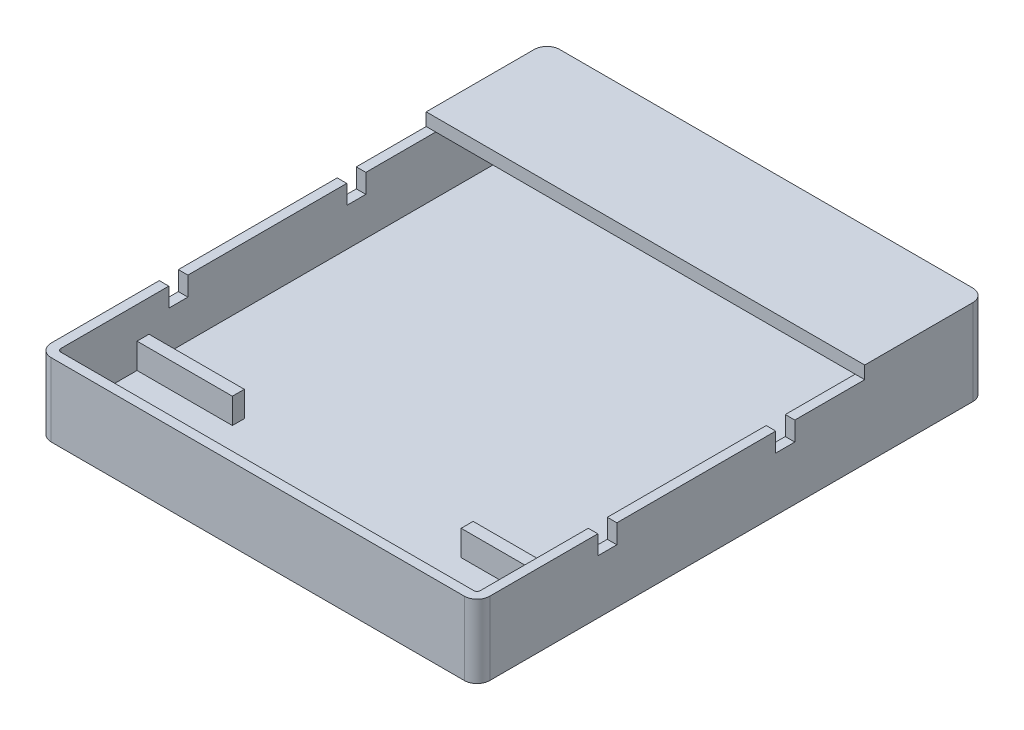
from build123d import *

# Parameters (mm, degrees)
EXTRUDE_1_DEPTH     = 2.5
EXTRUDE_2_DEPTH     = 9
SKETCH_6_W          = 14
SKETCH_6_H          = 8
SKETCH_6_W_2        = 9
SKETCH_6_H_2        = 5
CUT_EXTRUDE_3_DEPTH = 9
SKETCH_7_W          = 10
SKETCH_7_H          = 1.5
EXTRUDE_3_DEPTH     = 1
SKETCH_8_W          = 3
SKETCH_8_H          = 3
CUT_EXTRUDE_4_DEPTH = 5
EXTRUDE_4_DEPTH     = 2
SKETCH_10_W         = 15
SKETCH_10_H         = 1.883979019
EXTRUDE_5_DEPTH     = 4


with BuildPart() as part:
    # 草图1 → 凸台-拉伸1 (new body)
    with BuildSketch(Plane(origin=(0, 0, 0), x_dir=(1, 0, 0), z_dir=(0, 1, 0))):
        with BuildLine():
            Line((-32.5, 40), (32.5, 40))
            ThreePointArc((32.5, 40), (33.914213562, 39.414213562), (34.5, 38))
            Line((34.5, 38), (34.5, -38))
            ThreePointArc((34.5, -38), (33.914213562, -39.414213562), (32.5, -40))
            Line((32.5, -40), (-32.5, -40))
            ThreePointArc((-32.5, -40), (-33.914213562, -39.414213562), (-34.5, -38))
            Line((-34.5, -38), (-34.5, 38))
            ThreePointArc((-34.5, 38), (-33.914213562, 39.414213562), (-32.5, 40))
        make_face()
    extrude(amount=EXTRUDE_1_DEPTH)

    # 草图2 → 凸台-拉伸2 (add)
    with BuildSketch(Plane(origin=(0, 2.5, 0), x_dir=(1, 0, 0), z_dir=(0, 1, 0))):
        with BuildLine():
            Line((-32.5, -40), (32.5, -40))
            ThreePointArc((32.5, -40), (33.914213562, -39.414213562), (34.5, -38))
            Line((34.5, -38), (34.5, 38))
            ThreePointArc((34.5, 38), (33.914213562, 39.414213562), (32.5, 40))
            Line((32.5, 40), (-32.5, 40))
            ThreePointArc((-32.5, 40), (-33.914213562, 39.414213562), (-34.5, 38))
            Line((-34.5, 38), (-34.5, -38))
            ThreePointArc((-34.5, -38), (-33.914213562, -39.414213562), (-32.5, -40))
        make_face()
        with BuildLine():
            Line((-32.5, -38.5), (32.5, -38.5))
            ThreePointArc((32.5, -38.5), (32.853553391, -38.353553391), (33, -38))
            Line((33, -38), (33, 38))
            ThreePointArc((33, 38), (32.853553391, 38.353553391), (32.5, 38.5))
            Line((32.5, 38.5), (-32.5, 38.5))
            ThreePointArc((-32.5, 38.5), (-32.853553391, 38.353553391), (-33, 38))
            Line((-33, 38), (-33, -38))
            ThreePointArc((-33, -38), (-32.853553391, -38.353553391), (-32.5, -38.5))
        make_face(mode=Mode.SUBTRACT)
    extrude(amount=EXTRUDE_2_DEPTH)

    # 草图6 → 切除-拉伸3 (cut)
    with BuildSketch(Plane(origin=(0, 0, -40), x_dir=(-1, 0, 0), z_dir=(0, 0, -1))):
        with Locations((5.5, 6.5)):
            Rectangle(SKETCH_6_W, SKETCH_6_H)
        with Locations((-14, 5)):
            Rectangle(SKETCH_6_W_2, SKETCH_6_H_2)
    extrude(amount=-CUT_EXTRUDE_3_DEPTH, mode=Mode.SUBTRACT)

    # 草图7 → 凸台-拉伸3 (add)
    with BuildSketch(Plane(origin=(-33, 0, 0), x_dir=(0, 0, -1), z_dir=(1, 0, 0))):
        with Locations((33.771264053, 5.35)):
            Rectangle(SKETCH_7_W, SKETCH_7_H)
    extrude_3 = extrude(amount=EXTRUDE_3_DEPTH)

    # 镜向1: 凸台-拉伸3 across plane
    add(extrude_3.mirror(Plane(origin=(0, 0, 0), x_dir=(0, 0, 1), z_dir=(1, 0, 0))))

    # 草图8 → 切除-拉伸4 (cut)
    with BuildSketch(Plane(origin=(34.5, 0, 0), x_dir=(0, 0, -1), z_dir=(1, 0, 0))):
        with Locations((8.5, 10)):
            Rectangle(SKETCH_8_W, SKETCH_8_H)
        with Locations((-19.5, 10)):
            Rectangle(SKETCH_8_W, SKETCH_8_H)
    cut_extrude_4 = extrude(amount=-CUT_EXTRUDE_4_DEPTH, mode=Mode.SUBTRACT)

    # 镜向2: 切除-拉伸4 across plane
    add(cut_extrude_4.mirror(Plane(origin=(0, 0, 0), x_dir=(0, 0, 1), z_dir=(1, 0, 0))), mode=Mode.SUBTRACT)

    # 草图9 → 凸台-拉伸4 (add)
    with BuildSketch(Plane(origin=(0, 11.5, 0), x_dir=(1, 0, 0), z_dir=(0, 1, 0))):
        with BuildLine():
            Line((-34.5, 21), (34.5, 21))
            Line((34.5, 21), (34.5, 38))
            ThreePointArc((34.5, 38), (33.914213562, 39.414213562), (32.5, 40))
            Line((32.5, 40), (-32.5, 40))
            ThreePointArc((-32.5, 40), (-33.914213562, 39.414213562), (-34.5, 38))
            Line((-34.5, 38), (-34.5, 21))
        make_face()
    extrude(amount=EXTRUDE_4_DEPTH)

    # 草图10 → 凸台-拉伸5 (add)
    with BuildSketch(Plane(origin=(0, 2.5, 0), x_dir=(1, 0, 0), z_dir=(0, 1, 0))):
        with Locations((-25.5, -25.058010491)):
            Rectangle(SKETCH_10_W, SKETCH_10_H)
        with Locations((25.5, -25.058010491)):
            Rectangle(SKETCH_10_W, SKETCH_10_H)
    extrude(amount=EXTRUDE_5_DEPTH)


solid = part.part
